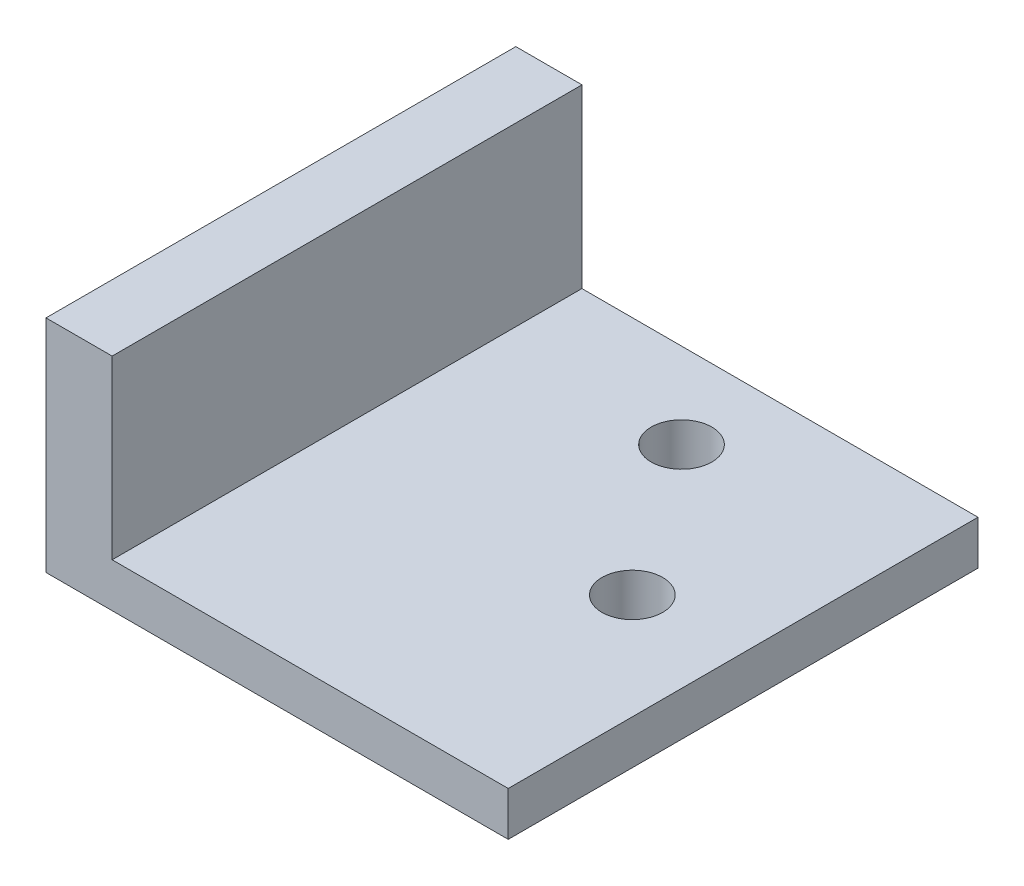
from build123d import *

# Parameters (mm, degrees)
SKETCH1_W           = 13.959881784
SKETCH1_H           = 21.302203019
SKETCH1_R           = 1.375
BOSS_EXTRUDE1_DEPTH = 2
SKETCH2_W           = 4
SKETCH2_H           = 21.302203019
BOSS_EXTRUDE2_DEPTH = 2
SKETCH3_W           = 3
SKETCH3_H           = 21.305070201
BOSS_EXTRUDE3_DEPTH = 10


with BuildPart() as part:
    # Sketch1 → Boss-Extrude1 (new body)
    with BuildSketch(Plane(origin=(0, 0, 0), x_dir=(1, 0, 0), z_dir=(0, 1, 0))):
        with Locations((0, 5.330617365)):
            Rectangle(SKETCH1_W, SKETCH1_H)
        with Locations(Location((-2.597025086, 12.115208791, 0), (0, 0, 270))):
            Circle(SKETCH1_R, mode=Mode.SUBTRACT)
        with Locations(Location((2.193295037, 5.093611172, 0), (0, 0, 270))):
            Circle(SKETCH1_R, mode=Mode.SUBTRACT)
    extrude(amount=BOSS_EXTRUDE1_DEPTH)

    # Sketch2 → Boss-Extrude2 (add)
    with BuildSketch(Plane(origin=(0, 0, 0), x_dir=(1, 0, 0), z_dir=(0, 1, 0))):
        with Locations((-8.979940892, 5.330617365)):
            Rectangle(SKETCH2_W, SKETCH2_H)
    extrude(amount=BOSS_EXTRUDE2_DEPTH)

    # Sketch3 → Boss-Extrude3 (add)
    with BuildSketch(Plane(origin=(0, 0, 0), x_dir=(1, 0, 0), z_dir=(0, 1, 0))):
        with Locations((-12.479940892, 5.332050956)):
            Rectangle(SKETCH3_W, SKETCH3_H)
    extrude(amount=BOSS_EXTRUDE3_DEPTH)


solid = part.part
